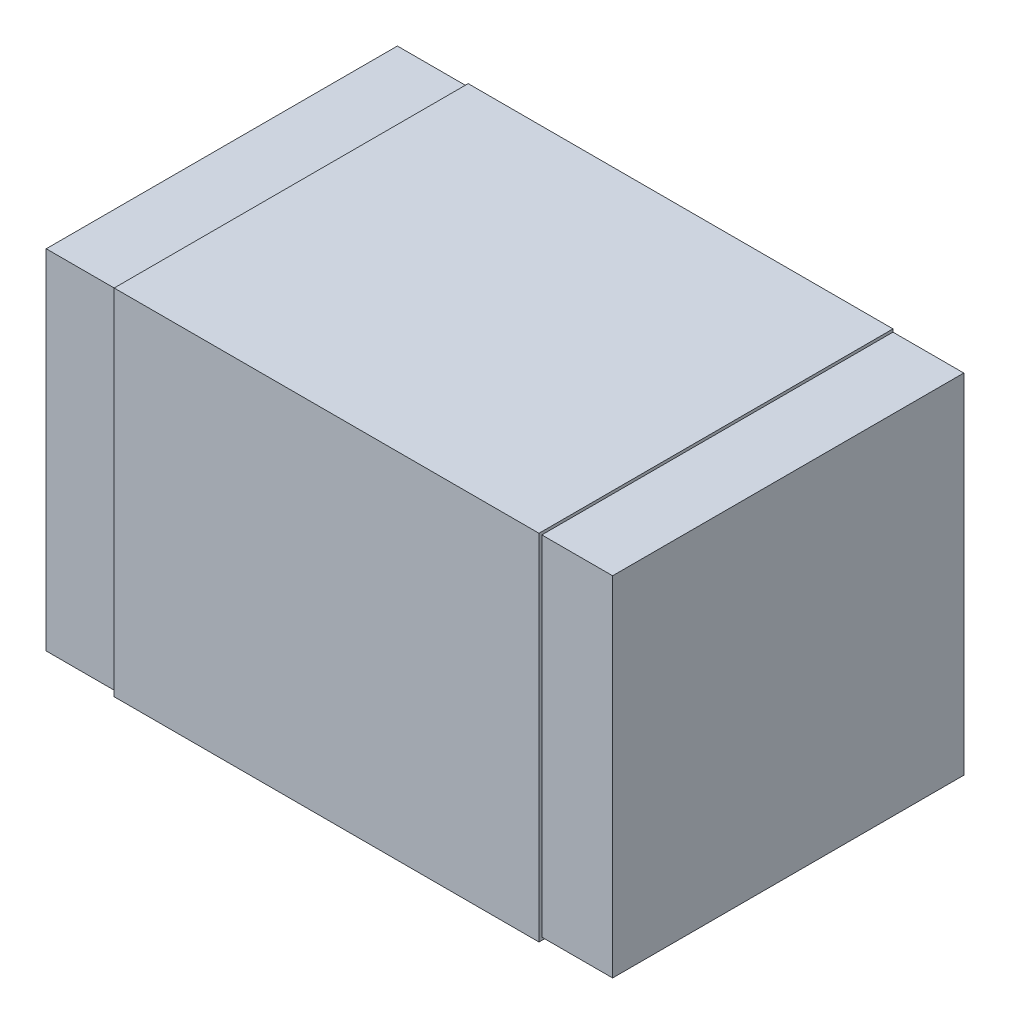
from build123d import *

# Parameters (mm, degrees)
SKETCH1_W           = 1.5
SKETCH1_H           = 1.25
BOSS_EXTRUDE1_DEPTH = 1.25
SKETCH4_W           = 0.25
SKETCH4_H           = 1.23
BOSS_EXTRUDE3_DEPTH = 1.24


with BuildPart() as part:
    # Sketch1 → Boss-Extrude1 (new body)
    with BuildSketch(Plane.XY):
        Rectangle(SKETCH1_W, SKETCH1_H)
    extrude(amount=BOSS_EXTRUDE1_DEPTH)

    # Sketch4 → Boss-Extrude3 (add)
    with BuildSketch(Plane(origin=(0, 0, 0), x_dir=(-1, 0, 0), z_dir=(0, 0, -1))):
        with Locations((-0.875, 0)):
            Rectangle(SKETCH4_W, SKETCH4_H)
        with Locations((0.875, 0)):
            Rectangle(SKETCH4_W, SKETCH4_H)
    extrude(amount=-BOSS_EXTRUDE3_DEPTH)


solid = part.part
